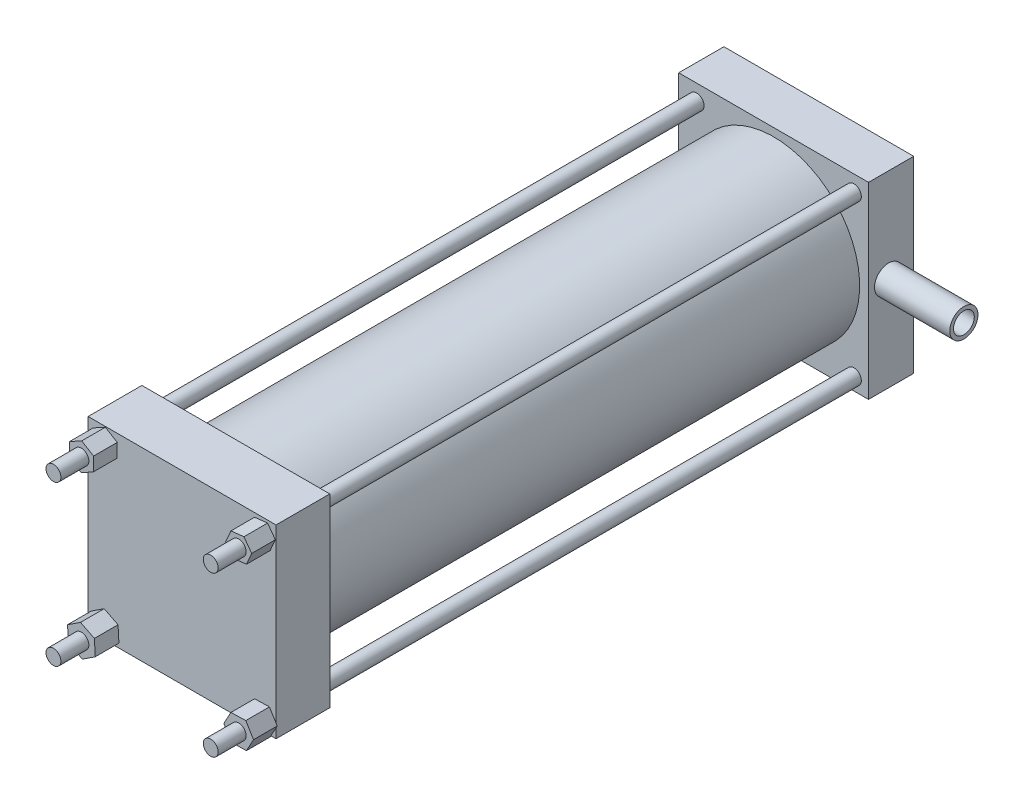
from build123d import *

# Parameters (mm, degrees)
SKETCH1_R           = 40
SKETCH1_R_2         = 30
BOSS_EXTRUDE1_DEPTH = 250
SKETCH2_W           = 87.3454085
SKETCH2_H           = 86.102689272
BOSS_EXTRUDE2_DEPTH = 25
SKETCH3_W           = 88.230119684
SKETCH3_H           = 87.397760064
SKETCH3_R           = 15.055192133
BOSS_EXTRUDE3_DEPTH = 21
SKETCH4_R           = 6.558948387
SKETCH4_R_2         = 4.836777433
BOSS_EXTRUDE4_DEPTH = 35
SKETCH5_R           = 3.463305275
BOSS_EXTRUDE5_DEPTH = 320
BOSS_EXTRUDE6_DEPTH = 11


with BuildPart() as part:
    # Sketch1 → Boss-Extrude1 (new body)
    with BuildSketch(Plane.XY):
        Circle(SKETCH1_R)
        Circle(SKETCH1_R_2, mode=Mode.SUBTRACT)
    extrude(amount=BOSS_EXTRUDE1_DEPTH)

    # Sketch2 → Boss-Extrude2 (add)
    with BuildSketch(Plane.XY.offset(250)):
        Rectangle(SKETCH2_W, SKETCH2_H)
    extrude(amount=BOSS_EXTRUDE2_DEPTH)

    # Sketch3 → Boss-Extrude3 (add)
    with BuildSketch(Plane(origin=(0, 0, 0), x_dir=(-1, 0, 0), z_dir=(0, 0, -1))):
        Rectangle(SKETCH3_W, SKETCH3_H)
        Circle(SKETCH3_R, mode=Mode.SUBTRACT)
    extrude(amount=BOSS_EXTRUDE3_DEPTH)

    # Sketch4 → Boss-Extrude4 (add)
    with BuildSketch(Plane(origin=(44.115059842, 0, 0), x_dir=(0, 0, -1), z_dir=(1, 0, 0))):
        with Locations(Location((9.33886413, 0, 0), (0, 0, 180))):
            Circle(SKETCH4_R)
        with Locations((9.33886413, 0)):
            Circle(SKETCH4_R_2, mode=Mode.SUBTRACT)
    extrude(amount=BOSS_EXTRUDE4_DEPTH)

    # Sketch5 → Boss-Extrude5 (add)
    with BuildSketch(Plane(origin=(0, 0, -21), x_dir=(-1, 0, 0), z_dir=(0, 0, -1))):
        with Locations((-37.317802409, 36.268502466)):
            Circle(SKETCH5_R)
        with Locations((35.79642007, 36.268502466)):
            Circle(SKETCH5_R)
        with Locations((35.79642007, -37.807749255)):
            Circle(SKETCH5_R)
        with Locations((-37.317802409, -37.807749255)):
            Circle(SKETCH5_R)
    extrude(amount=-BOSS_EXTRUDE5_DEPTH)

    # Sketch6 → Boss-Extrude6 (add)
    with BuildSketch(Plane.XY.offset(275)):
        Polygon((-30.267074755, 32.921442439), (-30.1331084, 39.383525962), (-35.662453716, 42.73058599), (-41.325765385, 39.615562494), (-41.45973174, 33.153478971), (-35.930386425, 29.806418943), align=None)
        Polygon((40.930579927, 31.363930691), (43.37167492, 36.944973688), (39.758897402, 41.849545463), (33.70502489, 41.173074242), (31.263929897, 35.592031245), (34.876707416, 30.68745947), align=None)
        Polygon((-29.350890947, -41.042634272), (-29.772162906, -33.843199803), (-36.217692029, -30.608314786), (-42.241949193, -34.572864239), (-41.820677234, -41.772298708), (-35.375148111, -45.007183725), align=None)
        Polygon((40.930579927, -43.698880032), (44.226060077, -37.624557535), (40.613282559, -31.733426758), (33.70502489, -31.916618479), (30.40954474, -37.990940976), (34.022322258, -43.882071753), align=None)
    extrude(amount=BOSS_EXTRUDE6_DEPTH)


solid = part.part
